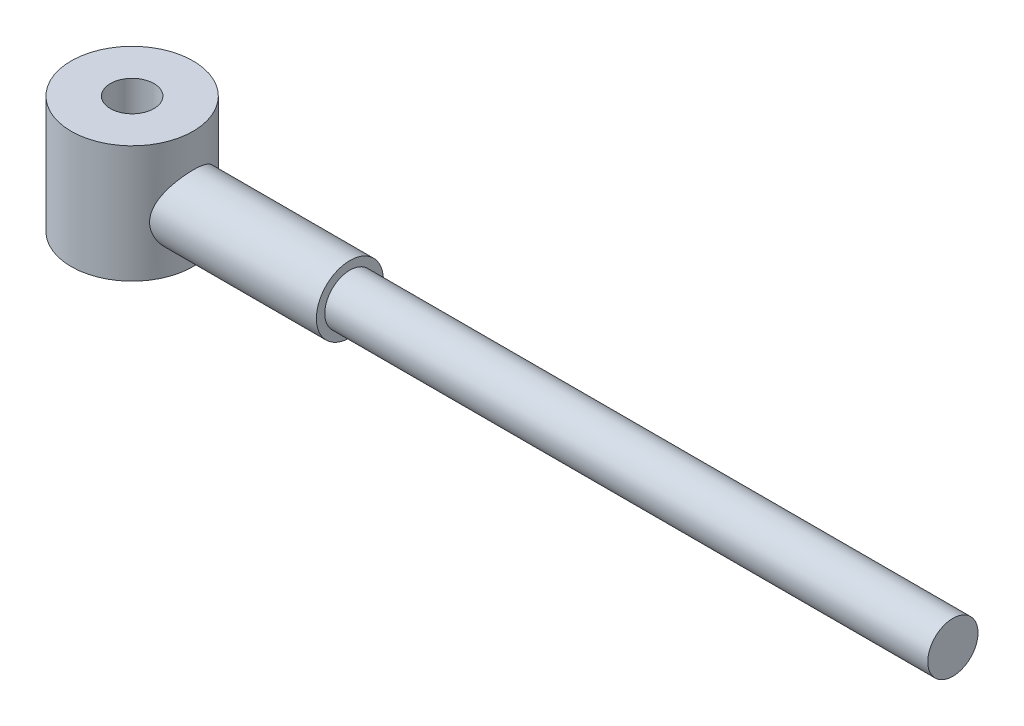
from build123d import *

# Parameters (mm, degrees)
BOSS_EXTRUDE1_DEPTH      = 20
BOSS_EXTRUDE1_DEPTH_BACK = 15
SKETCH2_R                = 18.2
SKETCH3_R                = 6.5
CUT_EXTRUDE1_DEPTH       = 55


with BuildPart() as part:
    # Sketch1 → Revolve1 (revolve)
    with BuildSketch(Plane.XY):
        Polygon((0, 0), (180, 0), (180, 7.5), (0, 7.5), (0, 10), (-50, 10), (-50, 0), align=None)
    revolve(axis=Axis((0, 0, 0), (-1, 0, 0)))

    # Sketch2 → Boss-Extrude1 (add, two sides: drawn at the far end of the back side and taken through both)
    with BuildSketch(Plane(origin=(0, 0, 0), x_dir=(1, 0, 0), z_dir=(0, 1, 0)).offset(-BOSS_EXTRUDE1_DEPTH_BACK)):
        with Locations(Location((-65, 0, 0), (0, 0, 270))):
            Circle(SKETCH2_R)
    extrude(amount=BOSS_EXTRUDE1_DEPTH + BOSS_EXTRUDE1_DEPTH_BACK)

    # Sketch3 → Cut-Extrude1 (cut)
    with BuildSketch(Plane(origin=(0, 20, 0), x_dir=(1, 0, 0), z_dir=(0, 1, 0))):
        with Locations(Location((-65, 0, 0), (0, 0, 270))):
            Circle(SKETCH3_R)
    extrude(amount=-CUT_EXTRUDE1_DEPTH, mode=Mode.SUBTRACT)


solid = part.part
